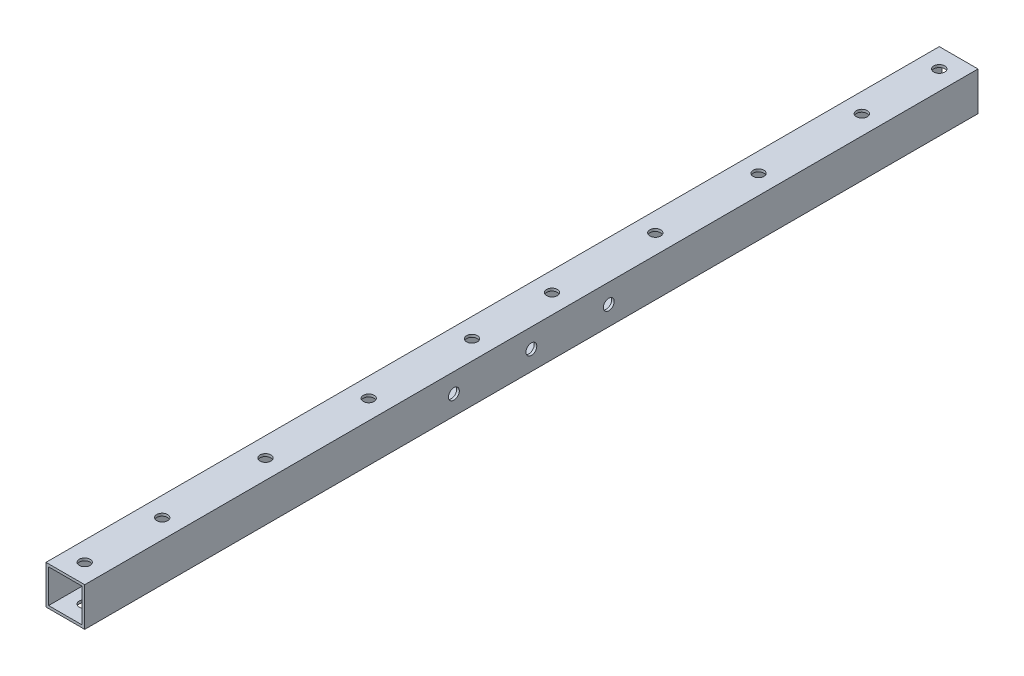
from build123d import *

# Parameters (mm, degrees)
SKETCH_1_W          = 15
SKETCH_1_H          = 15
SKETCH_1_W_2        = 13
SKETCH_1_H_2        = 13
EXTRUDE_1_DEPTH     = 346
SKETCH_3_R          = 2.1
CUT_EXTRUDE_2_DEPTH = 55
SKETCH_4_R          = 2.1
CUT_EXTRUDE_3_DEPTH = 55


with BuildPart() as part:
    # 草图1 → 凸台-拉伸1 (new body)
    with BuildSketch(Plane.XY):
        Rectangle(SKETCH_1_W, SKETCH_1_H)
        Rectangle(SKETCH_1_W_2, SKETCH_1_H_2, mode=Mode.SUBTRACT)
    extrude(amount=EXTRUDE_1_DEPTH)

    # 草图3 → 切除-拉伸2 (cut)
    with BuildSketch(Plane(origin=(0, 7.5, 0), x_dir=(1, 0, 0), z_dir=(0, 1, 0))):
        with Locations(Location((0, -338.5, 0), (0, 0, 270))):
            Circle(SKETCH_3_R)
        with Locations(Location((0, -7.5, 0), (0, 0, 270))):
            Circle(SKETCH_3_R)
        with Locations(Location((0, -37.5, 0), (0, 0, 270))):
            Circle(SKETCH_3_R)
        with Locations(Location((0, -308.5, 0), (0, 0, 270))):
            Circle(SKETCH_3_R)
        with Locations(Location((0, -77.5, 0), (0, 0, 270))):
            Circle(SKETCH_3_R)
        with Locations(Location((0, -117.5, 0), (0, 0, 270))):
            Circle(SKETCH_3_R)
        with Locations(Location((0, -228.5, 0), (0, 0, 270))):
            Circle(SKETCH_3_R)
        with Locations(Location((0, -268.5, 0), (0, 0, 270))):
            Circle(SKETCH_3_R)
        with Locations(Location((0, -157.5, 0), (0, 0, 270))):
            Circle(SKETCH_3_R)
        with Locations(Location((0, -188.5, 0), (0, 0, 270))):
            Circle(SKETCH_3_R)
    extrude(amount=-CUT_EXTRUDE_2_DEPTH, mode=Mode.SUBTRACT)

    # 草图4 → 切除-拉伸3 (cut)
    with BuildSketch(Plane(origin=(7.5, 0, 0), x_dir=(0, 0, -1), z_dir=(1, 0, 0))):
        with Locations((-173, 0)):
            Circle(SKETCH_4_R)
        with Locations((-203, 0)):
            Circle(SKETCH_4_R)
        with Locations((-143, 0)):
            Circle(SKETCH_4_R)
    extrude(amount=-CUT_EXTRUDE_3_DEPTH, mode=Mode.SUBTRACT)


solid = part.part
